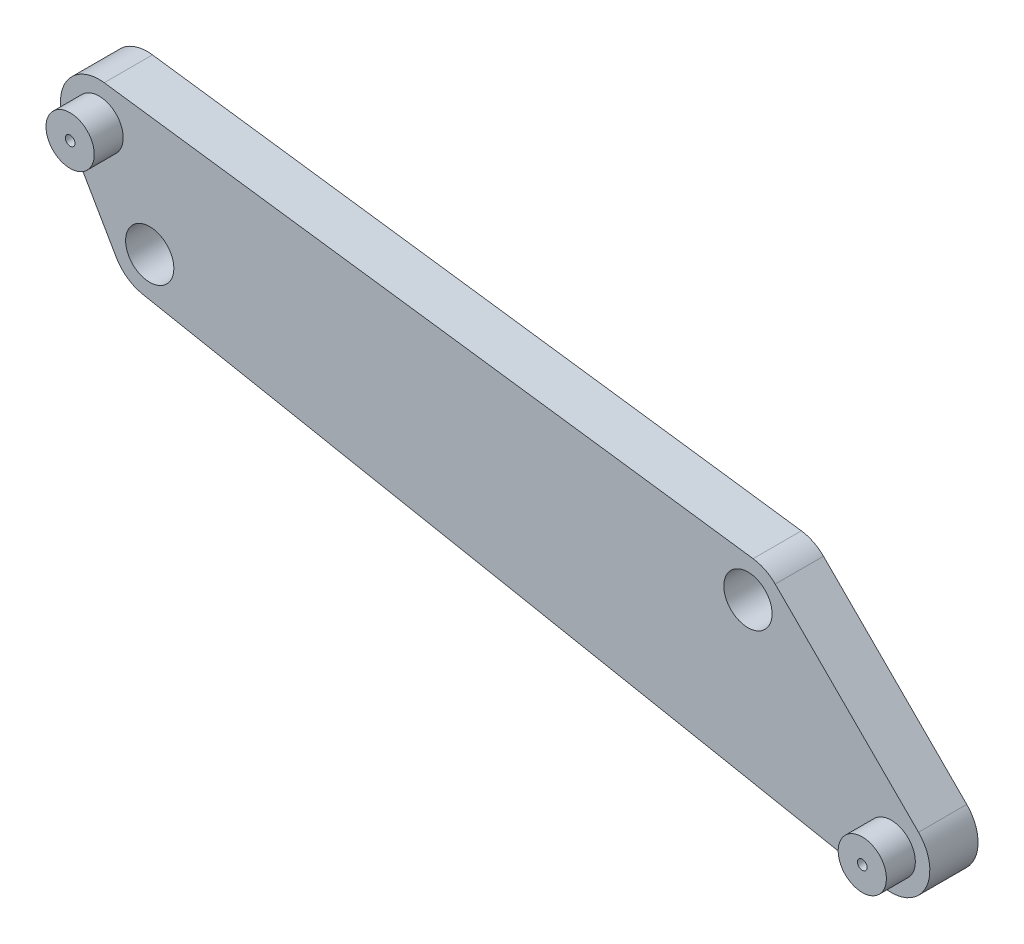
from build123d import *

# Parameters (mm, degrees)
SKETCH2_R           = 2.5
BOSS_EXTRUDE1_DEPTH = 5
SKETCH4_R           = 2.5
SKETCH4_R_2         = 0.5
BOSS_EXTRUDE3_DEPTH = 8


with BuildPart() as part:
    # Sketch2 → Boss-Extrude1 (new body)
    with BuildSketch(Plane.XY):
        with BuildLine():
            Line((-66.71401416, 13.057193982), (0.53598584, 3.963927242))
            ThreePointArc((0.53598584, 3.963927242), (1.775431998, 3.584388542), (2.828427125, 2.828427125))
            Line((2.828427125, 2.828427125), (17.67766953, -12.02081528))
            ThreePointArc((17.67766953, -12.02081528), (18.382077171, -16.725163117), (14.09037667, -18.776598105))
            Line((14.09037667, -18.776598105), (-62.758865735, -3.9273557))
            ThreePointArc((-62.758865735, -3.9273557), (-64.32099942, -3.257754087), (-65.464101615, -2))
            Line((-65.464101615, -2), (-70.714101615, 7.09326674))
            ThreePointArc((-70.714101615, 7.09326674), (-70.571983223, 11.321366258), (-66.71401416, 13.057193982))
        make_face()
        with Locations((-62, 0)):
            Circle(SKETCH2_R, mode=Mode.SUBTRACT)
        with Locations((-67.25, 9.09326674)):
            Circle(SKETCH2_R, mode=Mode.SUBTRACT)
        Circle(SKETCH2_R, mode=Mode.SUBTRACT)
        with Locations((14.849242405, -14.849242405)):
            Circle(SKETCH2_R, mode=Mode.SUBTRACT)
    extrude(amount=BOSS_EXTRUDE1_DEPTH)

    # Sketch4 → Boss-Extrude3 (add)
    # profile 1 of 2: a face of its own
    with BuildSketch(Plane(origin=(0, 0, 0), x_dir=(-1, 0, 0), z_dir=(0, 0, -1))):
        with Locations((67.25, 9.09326674)):
            Circle(SKETCH4_R)
        with Locations((67.25, 9.09326674)):
            Circle(SKETCH4_R_2, mode=Mode.SUBTRACT)
    # profile 2 of 2: a face of its own
    with BuildSketch(Plane(origin=(0, 0, 0), x_dir=(-1, 0, 0), z_dir=(0, 0, -1))):
        with Locations((-14.849242405, -14.849242405)):
            Circle(SKETCH4_R)
        with Locations((-14.849242405, -14.849242405)):
            Circle(SKETCH4_R_2, mode=Mode.SUBTRACT)
    extrude(amount=-BOSS_EXTRUDE3_DEPTH)


solid = part.part
